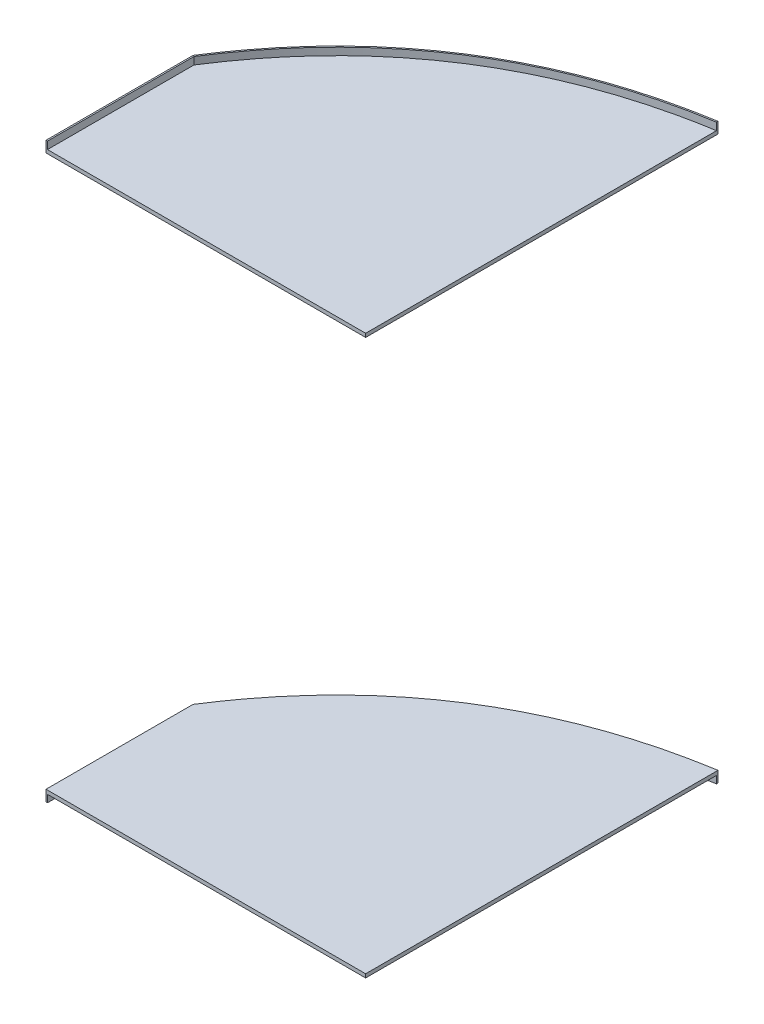
from build123d import *

# Parameters (mm, degrees)
BOSS_EXTRUDE1_DEPTH     = 6.35
BOSS_EXTRUDE3_DEPTH     = 6.35
BOSS_EXTRUDE5_DEPTH     = 12.7
BOSS_EXTRUDE6_DEPTH     = 12.7
CUT_EXTRUDE4_DEPTH      = 1728.012280013
CUT_EXTRUDE4_DEPTH_BACK = 1728.012280013
SKETCH15_W              = 190.5
SKETCH15_H              = 682.13068343


with BuildPart() as part:
    # Sketch1 → Boss-Extrude1 (new body)
    with BuildSketch(Plane(origin=(0, 0, 0), x_dir=(1, 0, 0), z_dir=(0, 1, 0))):
        with BuildLine():
            Line((89.610112992, -1165.433901317), (824.879284431, -1165.433901317))
            Line((824.879284431, -1165.433901317), (824.879284431, -567.502499631))
            ThreePointArc((824.879284431, -567.502499631), (817.269099996, -549.372897811), (798.9987756, -542.107045091))
            add(Edge.make_bspline(
                [(798.9987756, -542.107045091), (310.85287448, -551.343281294), (81.929284431, -911.433901317)],
                knots=[0, 0, 0, 1, 1, 1], degree=2))
            Line((81.929284431, -911.433901317), (81.929284431, -1165.433901317))
            Line((81.929284431, -1165.433901317), (89.610112992, -1165.433901317))
        make_face()
    extrude(amount=BOSS_EXTRUDE1_DEPTH)

    # Sketch7 → Boss-Extrude5 (add)
    with BuildSketch(Plane.XZ):
        with BuildLine():
            Line((81.929284431, 1165.433901317), (81.929284431, 911.433901317))
            add(Edge.make_bspline(
                [(81.929284431, 911.433901317), (310.852874413, 551.343281399), (798.998775313, 542.107045097)],
                knots=[0, 0, 0, 1, 1, 1], degree=2))
            Line((798.998775313, 542.107045097), (799.046826225, 544.64659055))
            add(Edge.make_bspline(
                [(84.469304621, 912.17350784), (103.445986698, 882.378231607), (124.011412428, 853.993941632), (168.593594737, 800.290538619), (192.61009119, 774.971194559), (224.984358741, 745.412322476), (231.577006451, 739.605162794), (241.646710977, 731.054934835), (246.726748812, 726.819950816), (251.875344395, 722.645853927), (255.323064638, 719.876731412), (257.054292928, 718.499226905), (272.671395942, 706.189149426), (286.866852119, 695.822531973), (330.365972729, 666.398283488), (360.581983591, 649.015511653), (407.626608262, 626.099997011), (423.595021874, 618.988123553), (447.965802624, 609.087960016), (456.159095509, 605.915857466), (468.552117196, 601.346939256), (472.700305171, 599.855506437), (481.030802365, 596.93527959), (485.213538017, 595.506425964), (506.136959561, 588.541794096), (522.966553896, 583.523018507), (556.791975897, 574.49711508), (573.787817466, 570.490071848), (607.932357178, 563.406226077), (625.08106614, 560.329489378), (659.519665029, 555.035202304), (676.809563487, 552.817703848), (728.875637539, 547.360312054), (763.847710868, 545.312595399), (799.046826225, 544.64659055)],
                knots=[0, 0, 0, 0, 0.125, 0.125, 0.25, 0.25, 0.28125, 0.28125, 0.296875, 0.3046875, 0.3046875, 0.3125, 0.3125, 0.375, 0.375, 0.5, 0.5, 0.5625, 0.5625, 0.59375, 0.59375, 0.609375, 0.609375, 0.625, 0.625, 0.6875, 0.6875, 0.75, 0.75, 0.8125, 0.8125, 0.875, 0.875, 1, 1, 1, 1], degree=3))
            Line((84.469304621, 912.17350784), (84.469304621, 1162.893900935))
            Line((84.469304621, 1162.893900935), (84.469304621, 1165.433901317))
            Line((84.469304621, 1165.433901317), (82.38244461, 1165.433901317))
            Line((82.38244461, 1165.433901317), (81.929284431, 1165.433901317))
        make_face()
    extrude(amount=BOSS_EXTRUDE5_DEPTH)


with BuildPart() as body_2:
    # Sketch3 → Boss-Extrude3 (new body)
    with BuildSketch(Plane(origin=(0, 958.85, 0), x_dir=(1, 0, 0), z_dir=(0, 1, 0))):
        with BuildLine():
            Line((81.92928454, -911.433901146), (81.929284431, -1165.433901317))
            Line((81.929284431, -1165.433901317), (824.879284431, -1165.433901317))
            Line((824.879284431, -1165.433901317), (824.879284431, -567.502499631))
            ThreePointArc((824.879284431, -567.502499631), (817.269099894, -549.37289771), (798.998775313, -542.107045097))
            add(Edge.make_bspline(
                [(798.998775313, -542.107045097), (310.852874529, -551.343281397), (81.92928454, -911.433901146)],
                knots=[0, 0, 0, 1, 1, 1], degree=2))
        make_face()
    extrude(amount=BOSS_EXTRUDE3_DEPTH)

    # Sketch8 → Boss-Extrude6 (add)
    with BuildSketch(Plane(origin=(0, 965.2, 0), x_dir=(1, 0, 0), z_dir=(0, 1, 0))):
        with BuildLine():
            Line((799.046826225, -544.64659055), (798.998775546, -542.107045092))
            add(Edge.make_bspline(
                [(798.998775546, -542.107045092), (310.852874466, -551.343281313), (81.92928443, -911.433901319)],
                knots=[0, 0, 0, 1, 1, 1], degree=2))
            Line((81.92928443, -911.433901319), (81.929284431, -1165.433901317))
            Line((81.929284431, -1165.433901317), (84.469304621, -1165.433901317))
            Line((84.469304621, -1165.433901317), (84.469304621, -912.17350784))
            add(Edge.make_bspline(
                [(84.469304621, -912.17350784), (103.445986698, -882.378231607), (124.011412428, -853.993941632), (168.593594737, -800.290538619), (192.61009119, -774.971194559), (224.984358741, -745.412322476), (236.521490923, -735.24979187), (248.427624153, -725.414976442), (255.323064638, -719.876731412), (257.054292928, -718.499226905), (272.671395942, -706.189149426), (286.866852119, -695.822531973), (330.365972729, -666.398283488), (360.581983591, -649.015511653), (407.626608262, -626.099997011), (423.595021874, -618.988123553), (447.965802624, -609.087960016), (460.255741598, -604.329805543), (472.700305171, -599.855506437), (481.030802365, -596.93527959), (485.213538017, -595.506425964), (506.136959561, -588.541794096), (522.966553896, -583.523018507), (556.791975897, -574.49711508), (573.787817466, -570.490071848), (607.932357178, -563.406226077), (625.08106614, -560.329489378), (659.519665029, -555.035202304), (676.809563487, -552.817703848), (728.875637539, -547.360312054), (763.847710868, -545.312595399), (799.046826225, -544.64659055)],
                knots=[0, 0, 0, 0, 0.125, 0.125, 0.25, 0.25, 0.28125, 0.3046875, 0.3046875, 0.3125, 0.3125, 0.375, 0.375, 0.5, 0.5, 0.5625, 0.5625, 0.59375, 0.609375, 0.609375, 0.625, 0.625, 0.6875, 0.6875, 0.75, 0.75, 0.8125, 0.8125, 0.875, 0.875, 1, 1, 1, 1], degree=3))
        make_face()
    extrude(amount=BOSS_EXTRUDE6_DEPTH)


with BuildPart() as cut_extrude4_tool:
    # Sketch15 → Cut-Extrude4 (new, two sides: drawn at the far end of the back side and taken through both)
    with BuildSketch(Plane(origin=(0, 958.85, 0), x_dir=(1, 0, 0), z_dir=(0, 1, 0)).offset(-CUT_EXTRUDE4_DEPTH_BACK)):
        with Locations((729.629284431, -824.368559602)):
            Rectangle(SKETCH15_W, SKETCH15_H)
    extrude(amount=CUT_EXTRUDE4_DEPTH + CUT_EXTRUDE4_DEPTH_BACK)


with BuildPart() as part_1:
    add(part.part)

    # Cut-Extrude4: cut by cut_extrude4_tool
    add(cut_extrude4_tool.part, mode=Mode.SUBTRACT)


with BuildPart() as body_2_1:
    add(body_2.part)

    # Cut-Extrude4: cut by cut_extrude4_tool
    add(cut_extrude4_tool.part, mode=Mode.SUBTRACT)


solid = Compound([part_1.part, body_2_1.part])
